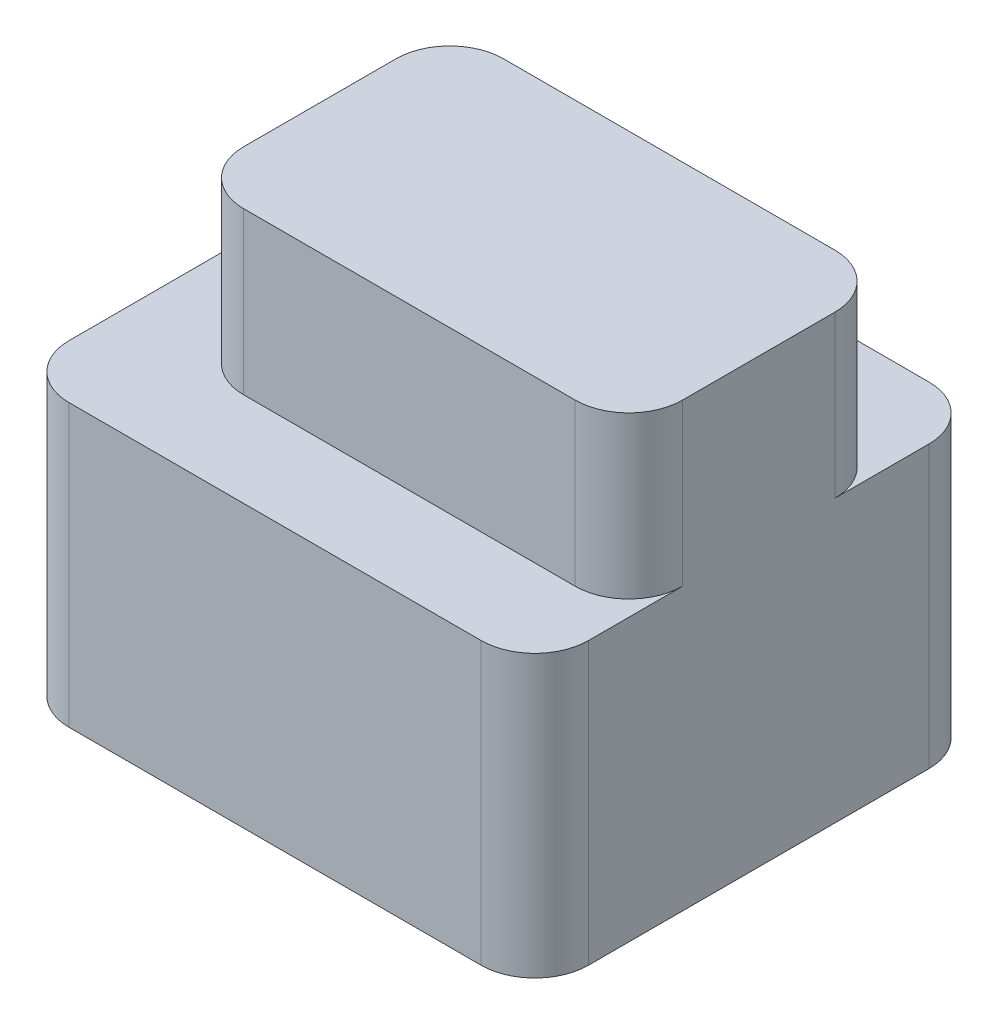
from build123d import *

# Parameters (mm, degrees)
SKETCH1_W           = 5.8
SKETCH1_H           = 5
BOSS_EXTRUDE1_DEPTH = 0.8
SKETCH2_W           = 4.9
SKETCH2_H           = 2.9
BOSS_EXTRUDE2_DEPTH = 1.8
FILLET1_R           = 0.6
BOSS_EXTRUDE3_DEPTH = 2.34


with BuildPart() as part:
    # Sketch1 → Boss-Extrude1 (new body)
    with BuildSketch(Plane.XZ):
        with Locations((2.9, 112.5)):
            Rectangle(SKETCH1_W, SKETCH1_H)
    extrude(amount=-BOSS_EXTRUDE1_DEPTH)

    # Sketch2 → Boss-Extrude2 (add)
    with BuildSketch(Plane(origin=(0, 0.8, 0), x_dir=(-1, 0, 0), z_dir=(0, 1, 0))):
        with Locations((-3.35, 112.5)):
            Rectangle(SKETCH2_W, SKETCH2_H)
    extrude(amount=BOSS_EXTRUDE2_DEPTH)

    # Fillet1
    fillet1_edges = [part.edges().sort_by_distance(p)[0] for p in [
        (5.8, 1.7, 113.95),
        (5.8, 1.7, 111.05),
        (0.9, 1.7, 111.05),
        (0.9, 1.7, 113.95),
        (0, 0.4, 115),
        (5.8, 0.4, 115),
        (5.8, 0.4, 110),
        (0, 0.4, 110),
    ]]
    fillet(fillet1_edges, radius=FILLET1_R)

    # Sketch3 → Boss-Extrude3 (add)
    with BuildSketch(Plane.XZ):
        with BuildLine():
            Line((0.6, 110), (5.2, 110))
            ThreePointArc((5.2, 110), (5.624264069, 110.175735931), (5.8, 110.6))
            Line((5.8, 110.6), (5.8, 114.4))
            ThreePointArc((5.8, 114.4), (5.624264069, 114.824264069), (5.2, 115))
            Line((5.2, 115), (0.6, 115))
            ThreePointArc((0.6, 115), (0.175735931, 114.824264069), (0, 114.4))
            Line((0, 114.4), (0, 110.6))
            ThreePointArc((0, 110.6), (0.175735931, 110.175735931), (0.6, 110))
        make_face()
    extrude(amount=BOSS_EXTRUDE3_DEPTH)


solid = part.part
